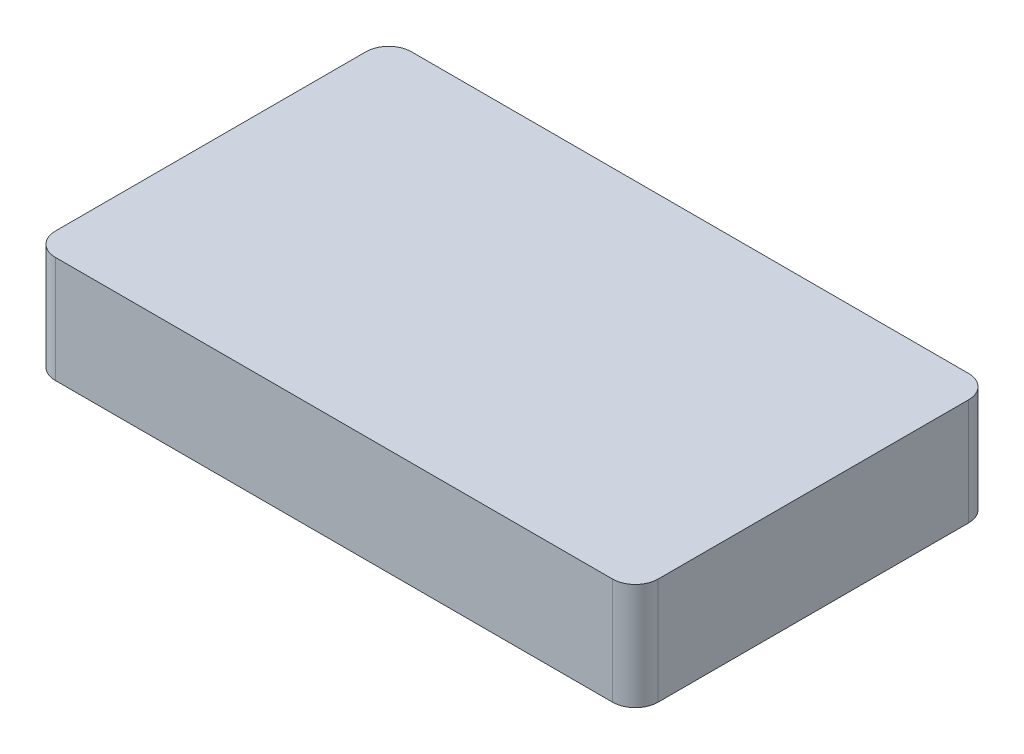
from build123d import *

# Parameters (mm, degrees)
BOSS_EXTRUDE1_DEPTH = 23.4


with BuildPart() as part:
    # Sketch1 → Boss-Extrude1 (new body)
    with BuildSketch(Plane(origin=(0, 0, 0), x_dir=(1, 0, 0), z_dir=(0, 1, 0))):
        with BuildLine():
            Line((5, 0), (127.2, 0))
            ThreePointArc((127.2, 0), (130.735533906, 1.464466094), (132.2, 5))
            Line((132.2, 5), (132.2, 73.1))
            ThreePointArc((132.2, 73.1), (130.735533906, 76.635533906), (127.2, 78.1))
            Line((127.2, 78.1), (5, 78.1))
            ThreePointArc((5, 78.1), (1.464466094, 76.635533906), (0, 73.1))
            Line((0, 73.1), (0, 5))
            ThreePointArc((0, 5), (1.464466094, 1.464466094), (5, 0))
        make_face()
    extrude(amount=BOSS_EXTRUDE1_DEPTH)


solid = part.part
